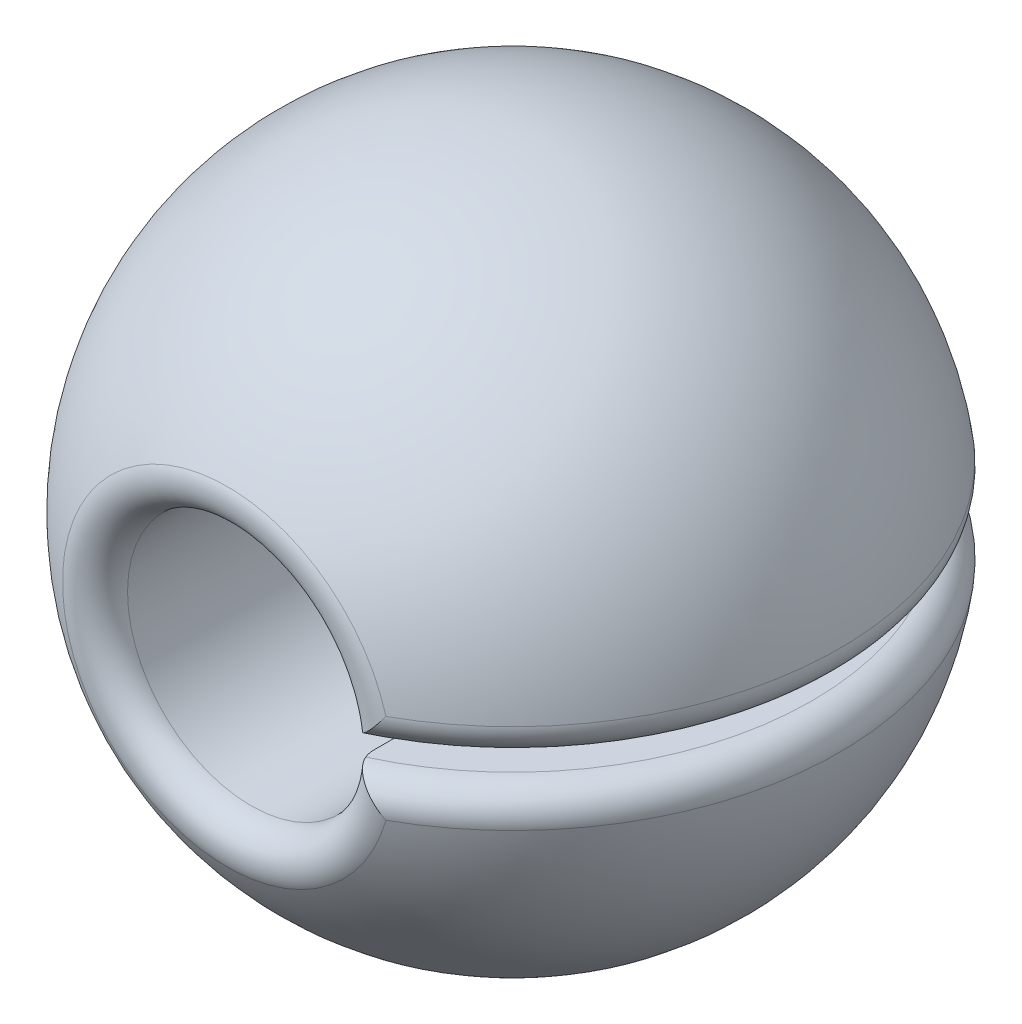
from build123d import *

# Parameters (mm, degrees)
SKETCH_2_R          = 4.5
CUT_EXTRUDE_1_DEPTH = 15
SKETCH_3_W          = 14.706599393
SKETCH_3_H          = 1
CUT_EXTRUDE_2_DEPTH = 23
FILLET_1_R          = 1


with BuildPart() as part:
    # 스케치1 → 회전2 (revolve)
    with BuildSketch(Plane.XY):
        with BuildLine():
            Line((0, 12), (0, -12))
            ThreePointArc((0, -12), (-12, 0), (0, 12))
        make_face()
    revolve(axis=Axis((0, 11.789684906, 0), (0, -1, 0)))

    # 스케치2 → 컷-돌출1 (cut, symmetric)
    with BuildSketch(Plane.XY):
        with Locations(Location((0, 0, 0), (0, 0, 180))):
            Circle(SKETCH_2_R)
    extrude(amount=CUT_EXTRUDE_1_DEPTH, both=True, mode=Mode.SUBTRACT)

    # 스케치3 → 컷-돌출2 (cut, symmetric)
    with BuildSketch(Plane.XY):
        with Locations((9.445081402, 0)):
            Rectangle(SKETCH_3_W, SKETCH_3_H)
    extrude(amount=CUT_EXTRUDE_2_DEPTH, both=True, mode=Mode.SUBTRACT)

    # 필렛1
    fillet_1_edges = [part.edges().sort_by_distance(p)[0] for p in [
        (-0.2503879, 4.493028547, 11.124297731),
        (11.989578808, 0.5, 0),
        (11.989578808, -0.5, 0),
        (-0.2503879, 4.493028547, -11.124297731),
    ]]
    fillet(fillet_1_edges, radius=FILLET_1_R)


solid = part.part
